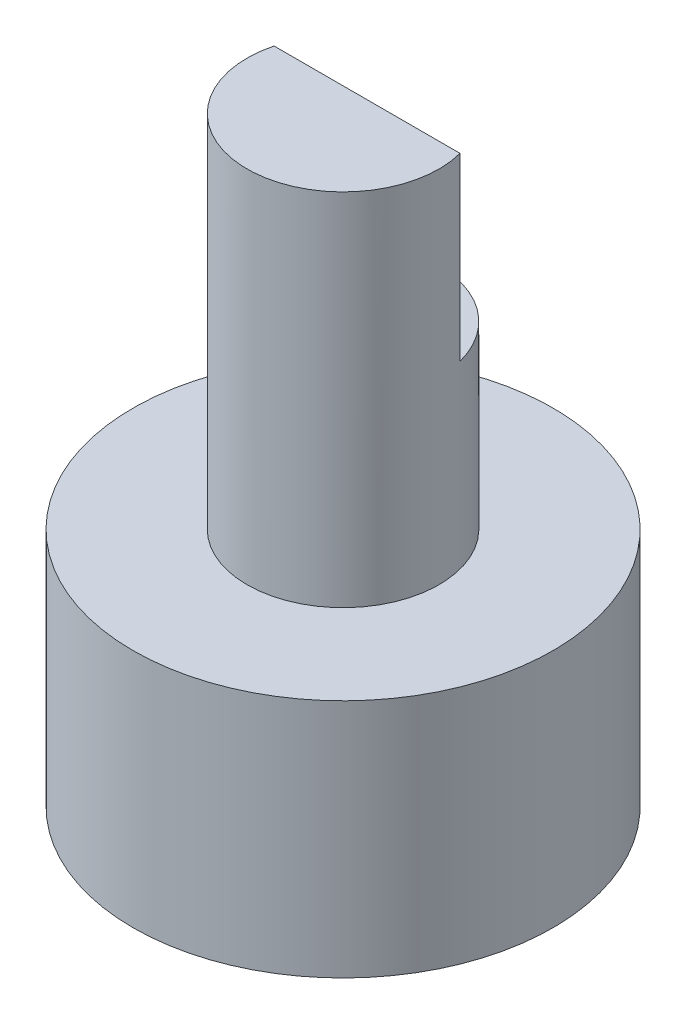
from build123d import *

# Parameters (mm, degrees)
SKETCH1_R           = 7
BOSS_EXTRUDE1_DEPTH = 8
SKETCH2_R           = 3.2
BOSS_EXTRUDE2_DEPTH = 12
SKETCH3_W           = 6.196773354
SKETCH3_H           = 3.205100748
CUT_EXTRUDE1_DEPTH  = 6
SKETCH4_R           = 1.25
CUT_EXTRUDE2_DEPTH  = 10


with BuildPart() as part:
    # Sketch1 → Boss-Extrude1 (new body)
    with BuildSketch(Plane(origin=(0, 0, 0), x_dir=(1, 0, 0), z_dir=(0, 1, 0))):
        with Locations(Location((0, 0, 0), (0, 0, 270))):
            Circle(SKETCH1_R)
    extrude(amount=BOSS_EXTRUDE1_DEPTH)

    # Sketch2 → Boss-Extrude2 (add)
    with BuildSketch(Plane(origin=(0, 8, 0), x_dir=(1, 0, 0), z_dir=(0, 1, 0))):
        with Locations(Location((0, 0, 0), (0, 0, 270))):
            Circle(SKETCH2_R)
    extrude(amount=BOSS_EXTRUDE2_DEPTH)

    # Sketch3 → Cut-Extrude1 (cut)
    with BuildSketch(Plane(origin=(0, 20, 0), x_dir=(1, 0, 0), z_dir=(0, 1, 0))):
        with Locations((0, 2.402550374)):
            Rectangle(SKETCH3_W, SKETCH3_H)
    extrude(amount=-CUT_EXTRUDE1_DEPTH, mode=Mode.SUBTRACT)

    # Sketch4 → Cut-Extrude2 (cut)
    with BuildSketch(Plane.XZ):
        with Locations(Location((0, 0, 0), (0, 0, 270))):
            Circle(SKETCH4_R)
    extrude(amount=-CUT_EXTRUDE2_DEPTH, mode=Mode.SUBTRACT)


solid = part.part
